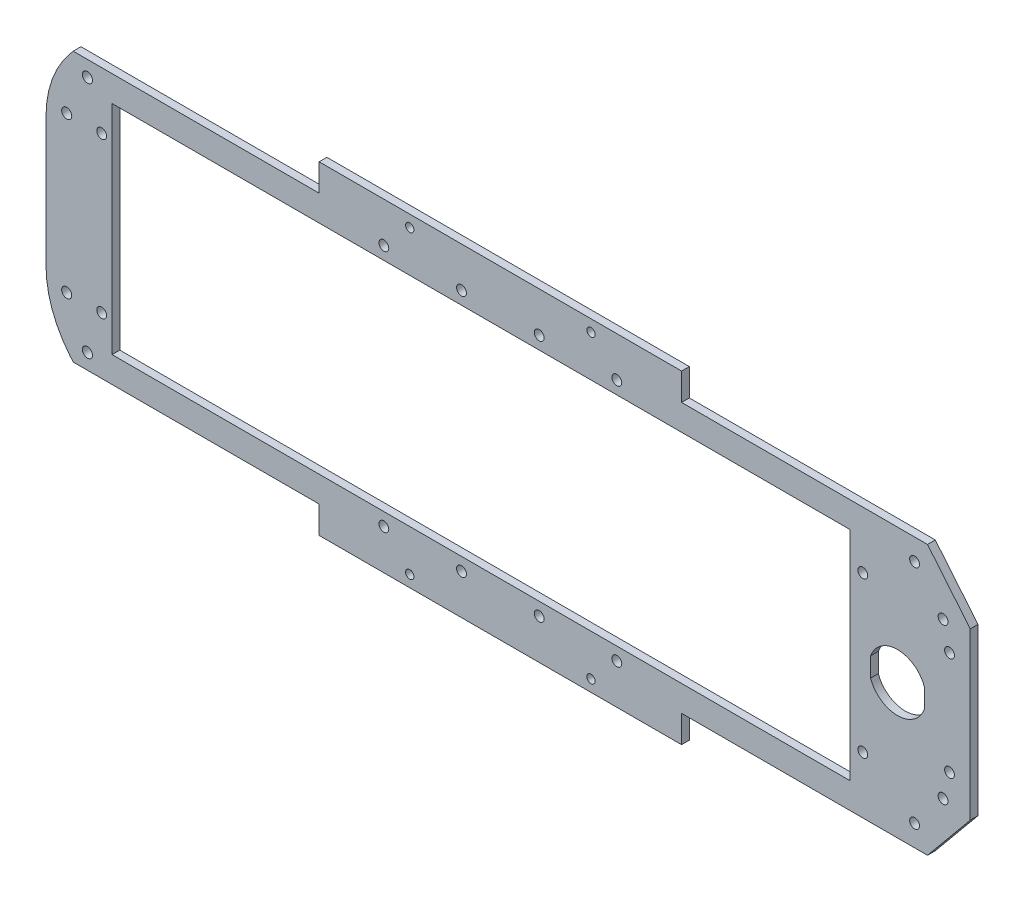
from build123d import *

# Parameters (mm, degrees)
BOSS_EXTRUDE1_DEPTH            = 3
SKETCH2_W                      = 285
SKETCH2_H                      = 84
CUT_EXTRUDE1_DEPTH             = 3
SKETCH3_R                      = 1.95
SKETCH3_R_2                    = 1.6
CUT_EXTRUDE2_DEPTH             = 3
CUT_EXTRUDE3_DEPTH             = 3
SKETCH5_R                      = 1.9
CUT_EXTRUDE4_DEPTH             = 3
SKETCH7_W                      = 36.585559037
SKETCH7_H                      = 111.194930045
CUT_EXTRUDE5_DEPTH             = 10
FILLET1_R                      = 40
SKETCH6_R                      = 1.9
EXPANSION_MOUNTING_HOLES_DEPTH = 10


with BuildPart() as part:
    # Sketch1 → Boss-Extrude1 (new body)
    with BuildSketch(Plane.XY):
        Polygon((-70, 89.297239119), (70, 89.297239119), (70, 78.797239119), (165, 78.797239119), (181.5, 58.797239119), (181.5, -5.202760881), (165, -25.202760881), (70, -25.202760881), (70, -35.702760881), (-70, -35.702760881), (-70, -25.202760881), (-165, -25.202760881), (-181.5, -5.202760881), (-181.5, 58.797239119), (-165, 78.797239119), (-70, 78.797239119), align=None)
    extrude(amount=BOSS_EXTRUDE1_DEPTH)

    # Sketch2 → Cut-Extrude1 (cut)
    with BuildSketch(Plane.XY.offset(3)):
        with Locations((-7.5, 26.797239119)):
            Rectangle(SKETCH2_W, SKETCH2_H)
    extrude(amount=-CUT_EXTRUDE1_DEPTH, mode=Mode.SUBTRACT)

    # Sketch3 → Cut-Extrude2 (cut)
    with BuildSketch(Plane.XY.offset(3)):
        with Locations((-167.5, -3.202760881)):
            Circle(SKETCH3_R)
        with Locations((-167.5, 56.797239119)):
            Circle(SKETCH3_R)
        with Locations((-35, -31.202760881)):
            Circle(SKETCH3_R_2)
        with Locations((35, -31.202760881)):
            Circle(SKETCH3_R_2)
        with Locations((-35, 84.797239119)):
            Circle(SKETCH3_R_2)
        with Locations((35, 84.797239119)):
            Circle(SKETCH3_R_2)
        with Locations((-159.5, 72.797239119)):
            Circle(SKETCH3_R)
        with Locations((-159.5, -19.202760881)):
            Circle(SKETCH3_R)
    extrude(amount=-CUT_EXTRUDE2_DEPTH, mode=Mode.SUBTRACT)

    # Sketch4 → Cut-Extrude3 (cut)
    with BuildSketch(Plane.XY.offset(3)):
        with BuildLine():
            Line((163.8, 30.531204839), (163.8, 23.063273399))
            ThreePointArc((163.8, 23.063273399), (153.4, 15.747239119), (143, 23.063273399))
            Line((143, 23.063273399), (143, 30.531204839))
            ThreePointArc((143, 30.531204839), (153.4, 37.847239119), (163.8, 30.531204839))
        make_face()
    extrude(amount=-CUT_EXTRUDE3_DEPTH, mode=Mode.SUBTRACT)

    # Sketch5 → Cut-Extrude4 (cut)
    with BuildSketch(Plane.XY.offset(3)):
        with Locations((173.5, 6.797239119)):
            Circle(SKETCH5_R)
        with Locations((173.5, 46.797239119)):
            Circle(SKETCH5_R)
        with Locations((140, 56.797239119)):
            Circle(SKETCH5_R)
        with Locations((140, -3.202760881)):
            Circle(SKETCH5_R)
        with Locations((160, 70.547239119)):
            Circle(SKETCH5_R)
        with Locations((160, -16.952760881)):
            Circle(SKETCH5_R)
    extrude(amount=-CUT_EXTRUDE4_DEPTH, mode=Mode.SUBTRACT)

    # Sketch7 → Cut-Extrude5 (cut)
    with BuildSketch(Plane.XY.offset(3)):
        with Locations((-193.792779519, 34.073054392)):
            Rectangle(SKETCH7_W, SKETCH7_H)
    extrude(amount=-CUT_EXTRUDE5_DEPTH, mode=Mode.SUBTRACT)

    # Fillet1
    fillet1_edges = [part.edges().sort_by_distance(p)[0] for p in [
        (-175.5, 66.069966392, 1.5),
        (-175.5, -12.475488154, 1.5),
    ]]
    fillet(fillet1_edges, radius=FILLET1_R)

    # Sketch6 → Expansion mounting holes (cut)
    with BuildSketch(Plane.XY.offset(3)):
        with Locations((171, 56.797239119)):
            Circle(SKETCH6_R)
        with Locations((171, -3.202760881)):
            Circle(SKETCH6_R)
        with Locations((-154, 56.797239119)):
            Circle(SKETCH6_R)
        with Locations((-154, -3.202760881)):
            Circle(SKETCH6_R)
        with Locations((-45, 73.797239119)):
            Circle(SKETCH6_R)
        with Locations((-45, -20.202760881)):
            Circle(SKETCH6_R)
        with Locations((-15, -20.202760881)):
            Circle(SKETCH6_R)
        with Locations((-15, 73.797239119)):
            Circle(SKETCH6_R)
        with Locations((15, -20.202760881)):
            Circle(SKETCH6_R)
        with Locations((15, 73.797239119)):
            Circle(SKETCH6_R)
        with Locations((45, -20.202760881)):
            Circle(SKETCH6_R)
        with Locations((45, 73.797239119)):
            Circle(SKETCH6_R)
    extrude(amount=-EXPANSION_MOUNTING_HOLES_DEPTH, mode=Mode.SUBTRACT)


solid = part.part
